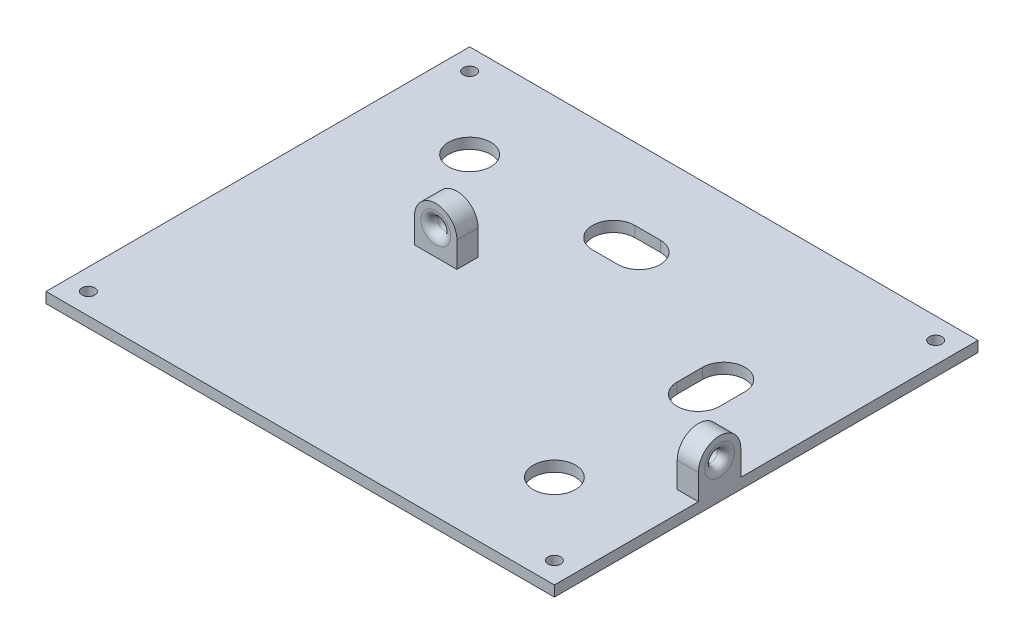
from build123d import *

# Parameters (mm, degrees)
SKETCH2_W           = 120
SKETCH2_H           = 100
BOSS_EXTRUDE1_DEPTH = 2.5
SKETCH3_R           = 1.5
CUT_EXTRUDE1_DEPTH  = 5
SKETCH4_R           = 5
CUT_EXTRUDE2_DEPTH  = 5
CUT_EXTRUDE3_DEPTH  = 10
SKETCH6_W           = 10
SKETCH6_H           = 5
SKETCH6_W_2         = 5
SKETCH6_H_2         = 10
BOSS_EXTRUDE2_DEPTH = 15
SKETCH7_R           = 1.5
CUT_EXTRUDE4_DEPTH  = 82.946628973
SKETCH8_R           = 1.5
CUT_EXTRUDE5_DEPTH  = 99.001275502
FILLET1_R           = 2
SKETCH9_W           = 10
SKETCH9_H           = 5
SKETCH9_W_2         = 5
SKETCH9_H_2         = 10
CUT_EXTRUDE6_DEPTH  = 15


with BuildPart() as part:
    # Sketch2 → Boss-Extrude1 (new body)
    with BuildSketch(Plane(origin=(0, 0, 0), x_dir=(1, 0, 0), z_dir=(0, 1, 0))):
        Rectangle(SKETCH2_W, SKETCH2_H)
    extrude(amount=BOSS_EXTRUDE1_DEPTH)

    # Sketch3 → Cut-Extrude1 (cut)
    with BuildSketch(Plane(origin=(0, 2.5, 0), x_dir=(1, 0, 0), z_dir=(0, 1, 0))):
        with Locations(Location((-55, 45, 0), (0, 0, 270))):
            Circle(SKETCH3_R)
        with Locations(Location((55, 45, 0), (0, 0, 270))):
            Circle(SKETCH3_R)
        with Locations(Location((55, -45, 0), (0, 0, 270))):
            Circle(SKETCH3_R)
        with Locations(Location((-55, -45, 0), (0, 0, 270))):
            Circle(SKETCH3_R)
    extrude(amount=-CUT_EXTRUDE1_DEPTH, mode=Mode.SUBTRACT)

    # Sketch4 → Cut-Extrude2 (cut)
    with BuildSketch(Plane(origin=(0, 2.5, 0), x_dir=(1, 0, 0), z_dir=(0, 1, 0))):
        with Locations(Location((-38, 28, 0), (0, 0, 270))):
            Circle(SKETCH4_R)
        with Locations(Location((-4, 28, 0), (0, 0, 270))):
            Circle(SKETCH4_R)
        with Locations(Location((38, 6, 0), (0, 0, 270))):
            Circle(SKETCH4_R)
        with Locations(Location((38, -28, 0), (0, 0, 270))):
            Circle(SKETCH4_R)
    extrude(amount=-CUT_EXTRUDE2_DEPTH, mode=Mode.SUBTRACT)

    # Sketch5 → Cut-Extrude3 (cut)
    with BuildSketch(Plane(origin=(0, 2.5, 0), x_dir=(1, 0, 0), z_dir=(0, 1, 0))):
        with BuildLine():
            Line((-4, 33), (2, 33))
            ThreePointArc((2, 33), (7, 28), (2, 23))
            Line((2, 23), (-4, 23))
            ThreePointArc((-4, 23), (-9, 28), (-4, 33))
        make_face()
        with BuildLine():
            Line((33, 6), (33, 12))
            ThreePointArc((33, 12), (38, 17), (43, 12))
            Line((43, 12), (43, 6))
            ThreePointArc((43, 6), (38, 1), (33, 6))
        make_face()
    extrude(amount=-CUT_EXTRUDE3_DEPTH, mode=Mode.SUBTRACT)

    # Sketch6 → Boss-Extrude2 (add)
    with BuildSketch(Plane(origin=(0, 2.5, 0), x_dir=(1, 0, 0), z_dir=(0, 1, 0))):
        with Locations((-21, 5.5)):
            Rectangle(SKETCH6_W, SKETCH6_H)
        with Locations((57.5, -11)):
            Rectangle(SKETCH6_W_2, SKETCH6_H_2)
        with Locations((-21, 47.5)):
            Rectangle(SKETCH6_W, SKETCH6_H)
        with Locations((15.5, -11)):
            Rectangle(SKETCH6_W_2, SKETCH6_H_2)
    extrude(amount=BOSS_EXTRUDE2_DEPTH)

    # Sketch7 → Cut-Extrude4 (cut, through all)
    with BuildSketch(Plane.XY.offset(-3)):
        with Locations((-21, 8.5)):
            Circle(SKETCH7_R)
        with BuildLine():
            Line((-16, 8.5), (-16, 17.5))
            Line((-16, 17.5), (-26, 17.5))
            Line((-26, 17.5), (-26, 8.5))
            ThreePointArc((-26, 8.5), (-21, 13.5), (-16, 8.5))
        make_face()
    extrude(amount=-CUT_EXTRUDE4_DEPTH, mode=Mode.SUBTRACT)

    # Sketch8 → Cut-Extrude5 (cut, through all)
    with BuildSketch(Plane(origin=(13, 0, -13), x_dir=(0, 0, 1), z_dir=(-1, 0, 0))):
        with Locations((24, 8.5)):
            Circle(SKETCH8_R)
        with BuildLine():
            Line((29, 8.5), (29, 17.5))
            Line((29, 17.5), (19, 17.5))
            Line((19, 17.5), (19, 8.5))
            ThreePointArc((19, 8.5), (24, 13.5), (29, 8.5))
        make_face()
    extrude(amount=-CUT_EXTRUDE5_DEPTH, mode=Mode.SUBTRACT)

    # Fillet1
    fillet1_edges = [part.edges().sort_by_distance(p)[0] for p in [
        (-22.5, 8.5, -8),
        (-22.5, 8.5, -50),
        (-22.5, 8.5, -45),
        (-22.5, 8.5, -3),
        (60, 8.5, 9.5),
        (55, 8.5, 9.5),
        (18, 8.5, 9.5),
        (13, 8.5, 9.5),
    ]]
    fillet(fillet1_edges, radius=FILLET1_R)

    # Sketch9 → Cut-Extrude6 (cut)
    with BuildSketch(Plane(origin=(0, 2.5, 0), x_dir=(1, 0, 0), z_dir=(0, 1, 0))):
        with Locations((-21, 47.5)):
            Rectangle(SKETCH9_W, SKETCH9_H)
        with Locations((15.5, -11)):
            Rectangle(SKETCH9_W_2, SKETCH9_H_2)
    extrude(amount=CUT_EXTRUDE6_DEPTH, mode=Mode.SUBTRACT)


solid = part.part
